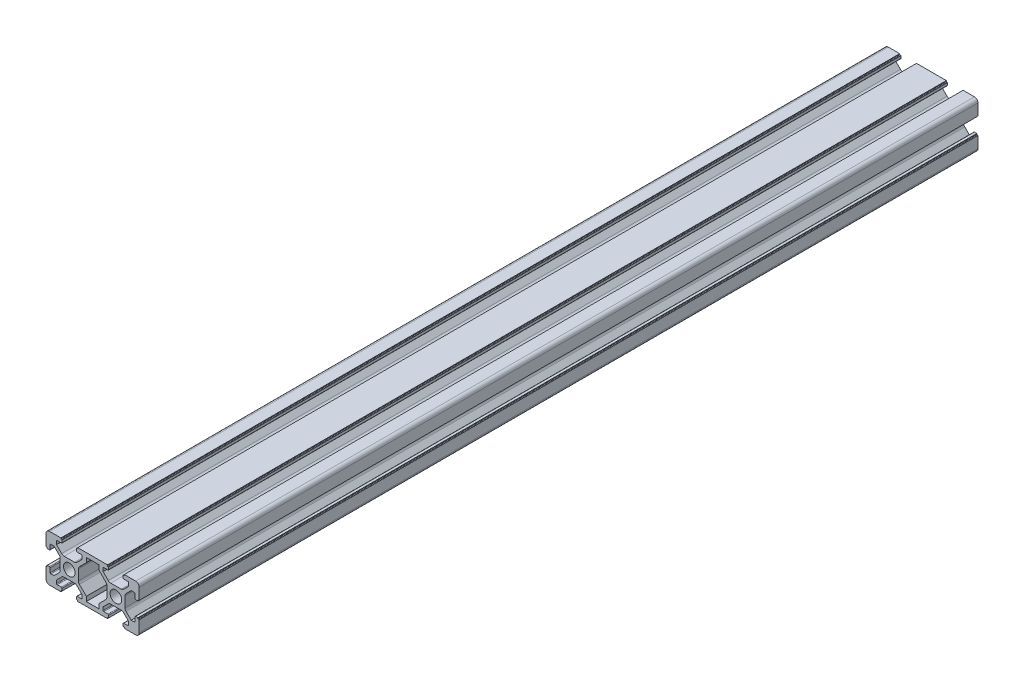
from build123d import *

# Parameters (mm, degrees)
SKETCH_1_R      = 2.5
EXTRUDE_1_DEPTH = 360


with BuildPart() as part:
    # 草图1 → 凸台-拉伸1 (new body)
    with BuildSketch(Plane.XY):
        with BuildLine():
            Line((-0.771587854, 9.545792426), (-5.671587854, 9.545792426))
            Line((-5.671587854, 9.545792426), (-5.671587854, 9.245792426))
            ThreePointArc((-5.671587854, 9.245792426), (-5.730166498, 9.10437107), (-5.871587854, 9.045792426))
            Line((-5.871587854, 9.045792426), (-6.171587854, 9.045792426))
            Line((-6.171587854, 9.045792426), (-6.171587854, 8.045792426))
            ThreePointArc((-6.171587854, 8.045792426), (-6.083719889, 7.833660392), (-5.871587854, 7.745792426))
            Line((-5.871587854, 7.745792426), (-4.071587854, 7.745792426))
            ThreePointArc((-4.071587854, 7.745792426), (-3.85945582, 7.657924461), (-3.771587854, 7.445792426))
            Line((-3.771587854, 7.445792426), (-3.771587854, 6.105792426))
            Line((-3.771587854, 6.105792426), (-5.992248026, 3.885132255))
            ThreePointArc((-5.992248026, 3.885132255), (-6.478883049, 3.559973128), (-7.052908198, 3.445792426))
            Line((-7.052908198, 3.445792426), (-11.490267511, 3.445792426))
            ThreePointArc((-11.490267511, 3.445792426), (-12.064292659, 3.559973128), (-12.550927682, 3.885132255))
            Line((-12.550927682, 3.885132255), (-14.771587854, 6.105792426))
            Line((-14.771587854, 6.105792426), (-14.771587854, 7.445792426))
            ThreePointArc((-14.771587854, 7.445792426), (-14.683719889, 7.657924461), (-14.471587854, 7.745792426))
            Line((-14.471587854, 7.745792426), (-12.671587854, 7.745792426))
            ThreePointArc((-12.671587854, 7.745792426), (-12.45945582, 7.833660392), (-12.371587854, 8.045792426))
            Line((-12.371587854, 8.045792426), (-12.371587854, 9.045792426))
            Line((-12.371587854, 9.045792426), (-12.671587854, 9.045792426))
            ThreePointArc((-12.671587854, 9.045792426), (-12.81300921, 9.10437107), (-12.871587854, 9.245792426))
            Line((-12.871587854, 9.245792426), (-12.871587854, 9.545792426))
            Line((-12.871587854, 9.545792426), (-17.771587854, 9.545792426))
            ThreePointArc((-17.771587854, 9.545792426), (-18.832248026, 9.106452598), (-19.271587854, 8.045792426))
            Line((-19.271587854, 8.045792426), (-19.271587854, 3.145792426))
            Line((-19.271587854, 3.145792426), (-18.971587854, 3.145792426))
            ThreePointArc((-18.971587854, 3.145792426), (-18.830166498, 3.087213783), (-18.771587854, 2.945792426))
            Line((-18.771587854, 2.945792426), (-18.771587854, 2.645792426))
            Line((-18.771587854, 2.645792426), (-17.771587854, 2.645792426))
            ThreePointArc((-17.771587854, 2.645792426), (-17.55945582, 2.733660392), (-17.471587854, 2.945792426))
            Line((-17.471587854, 2.945792426), (-17.471587854, 4.745792426))
            ThreePointArc((-17.471587854, 4.745792426), (-17.383719889, 4.957924461), (-17.171587854, 5.045792426))
            Line((-17.171587854, 5.045792426), (-15.831587854, 5.045792426))
            Line((-15.831587854, 5.045792426), (-13.610927682, 2.825132255))
            ThreePointArc((-13.610927682, 2.825132255), (-13.285768555, 2.338497231), (-13.171587854, 1.764472083))
            Line((-13.171587854, 1.764472083), (-13.171587854, -2.67288723))
            ThreePointArc((-13.171587854, -2.67288723), (-13.285768555, -3.246912379), (-13.610927682, -3.733547402))
            Line((-13.610927682, -3.733547402), (-15.831587854, -5.954207574))
            Line((-15.831587854, -5.954207574), (-17.171587854, -5.954207574))
            ThreePointArc((-17.171587854, -5.954207574), (-17.383719889, -5.866339608), (-17.471587854, -5.654207574))
            Line((-17.471587854, -5.654207574), (-17.471587854, -3.854207574))
            ThreePointArc((-17.471587854, -3.854207574), (-17.55945582, -3.642075539), (-17.771587854, -3.554207574))
            Line((-17.771587854, -3.554207574), (-18.771587854, -3.554207574))
            Line((-18.771587854, -3.554207574), (-18.771587854, -3.854207574))
            ThreePointArc((-18.771587854, -3.854207574), (-18.830166498, -3.99562893), (-18.971587854, -4.054207574))
            Line((-18.971587854, -4.054207574), (-19.271587854, -4.054207574))
            Line((-19.271587854, -4.054207574), (-19.271587854, -8.954207574))
            ThreePointArc((-19.271587854, -8.954207574), (-18.832248026, -10.014867745), (-17.771587854, -10.454207574))
            Line((-17.771587854, -10.454207574), (-12.871587854, -10.454207574))
            Line((-12.871587854, -10.454207574), (-12.871587854, -10.154207574))
            ThreePointArc((-12.871587854, -10.154207574), (-12.81300921, -10.012786217), (-12.671587854, -9.954207574))
            Line((-12.671587854, -9.954207574), (-12.371587854, -9.954207574))
            Line((-12.371587854, -9.954207574), (-12.371587854, -8.954207574))
            ThreePointArc((-12.371587854, -8.954207574), (-12.45945582, -8.742075539), (-12.671587854, -8.654207574))
            Line((-12.671587854, -8.654207574), (-14.471587854, -8.654207574))
            ThreePointArc((-14.471587854, -8.654207574), (-14.683719889, -8.566339608), (-14.771587854, -8.354207574))
            Line((-14.771587854, -8.354207574), (-14.771587854, -7.014207574))
            Line((-14.771587854, -7.014207574), (-12.550927682, -4.793547402))
            ThreePointArc((-12.550927682, -4.793547402), (-12.064292659, -4.468388275), (-11.490267511, -4.354207574))
            Line((-11.490267511, -4.354207574), (-7.052908198, -4.354207574))
            ThreePointArc((-7.052908198, -4.354207574), (-6.478883049, -4.468388275), (-5.992248026, -4.793547402))
            Line((-5.992248026, -4.793547402), (-3.771587854, -7.014207574))
            Line((-3.771587854, -7.014207574), (-3.771587854, -8.354207574))
            ThreePointArc((-3.771587854, -8.354207574), (-3.85945582, -8.566339608), (-4.071587854, -8.654207574))
            Line((-4.071587854, -8.654207574), (-5.871587854, -8.654207574))
            ThreePointArc((-5.871587854, -8.654207574), (-6.083719889, -8.742075539), (-6.171587854, -8.954207574))
            Line((-6.171587854, -8.954207574), (-6.171587854, -9.954207574))
            Line((-6.171587854, -9.954207574), (-5.871587854, -9.954207574))
            ThreePointArc((-5.871587854, -9.954207574), (-5.730166498, -10.012786217), (-5.671587854, -10.154207574))
            Line((-5.671587854, -10.154207574), (-5.671587854, -10.454207574))
            Line((-5.671587854, -10.454207574), (-0.771587854, -10.454207574))
            Line((-0.771587854, -10.454207574), (7.128412146, -10.454207574))
            Line((7.128412146, -10.454207574), (7.128412146, -10.154207574))
            ThreePointArc((7.128412146, -10.154207574), (7.18699079, -10.012786217), (7.328412146, -9.954207574))
            Line((7.328412146, -9.954207574), (7.628412146, -9.954207574))
            Line((7.628412146, -9.954207574), (7.628412146, -8.954207574))
            ThreePointArc((7.628412146, -8.954207574), (7.54054418, -8.742075539), (7.328412146, -8.654207574))
            Line((7.328412146, -8.654207574), (5.528412146, -8.654207574))
            ThreePointArc((5.528412146, -8.654207574), (5.316280111, -8.566339608), (5.228412146, -8.354207574))
            Line((5.228412146, -8.354207574), (5.228412146, -7.014207574))
            Line((5.228412146, -7.014207574), (7.449072318, -4.793547402))
            ThreePointArc((7.449072318, -4.793547402), (7.935707341, -4.468388275), (8.509732489, -4.354207574))
            Line((8.509732489, -4.354207574), (12.947091802, -4.354207574))
            ThreePointArc((12.947091802, -4.354207574), (13.521116951, -4.468388275), (14.007751974, -4.793547402))
            Line((14.007751974, -4.793547402), (16.228412146, -7.014207574))
            Line((16.228412146, -7.014207574), (16.228412146, -8.354207574))
            ThreePointArc((16.228412146, -8.354207574), (16.14054418, -8.566339608), (15.928412146, -8.654207574))
            Line((15.928412146, -8.654207574), (14.128412146, -8.654207574))
            ThreePointArc((14.128412146, -8.654207574), (13.916280111, -8.742075539), (13.828412146, -8.954207574))
            Line((13.828412146, -8.954207574), (13.828412146, -9.954207574))
            Line((13.828412146, -9.954207574), (14.128412146, -9.954207574))
            ThreePointArc((14.128412146, -9.954207574), (14.269833502, -10.012786217), (14.328412146, -10.154207574))
            Line((14.328412146, -10.154207574), (14.328412146, -10.454207574))
            Line((14.328412146, -10.454207574), (19.228412146, -10.454207574))
            ThreePointArc((19.228412146, -10.454207574), (20.289072318, -10.014867745), (20.728412146, -8.954207574))
            Line((20.728412146, -8.954207574), (20.728412146, -4.054207574))
            Line((20.728412146, -4.054207574), (20.428412146, -4.054207574))
            ThreePointArc((20.428412146, -4.054207574), (20.28699079, -3.99562893), (20.228412146, -3.854207574))
            Line((20.228412146, -3.854207574), (20.228412146, -3.554207574))
            Line((20.228412146, -3.554207574), (19.228412146, -3.554207574))
            ThreePointArc((19.228412146, -3.554207574), (19.016280111, -3.642075539), (18.928412146, -3.854207574))
            Line((18.928412146, -3.854207574), (18.928412146, -5.654207574))
            ThreePointArc((18.928412146, -5.654207574), (18.84054418, -5.866339608), (18.628412146, -5.954207574))
            Line((18.628412146, -5.954207574), (17.288412146, -5.954207574))
            Line((17.288412146, -5.954207574), (15.067751974, -3.733547402))
            ThreePointArc((15.067751974, -3.733547402), (14.742592847, -3.246912379), (14.628412146, -2.67288723))
            Line((14.628412146, -2.67288723), (14.628412146, 1.764472083))
            ThreePointArc((14.628412146, 1.764472083), (14.742592847, 2.338497231), (15.067751974, 2.825132255))
            Line((15.067751974, 2.825132255), (17.288412146, 5.045792426))
            Line((17.288412146, 5.045792426), (18.628412146, 5.045792426))
            ThreePointArc((18.628412146, 5.045792426), (18.84054418, 4.957924461), (18.928412146, 4.745792426))
            Line((18.928412146, 4.745792426), (18.928412146, 2.945792426))
            ThreePointArc((18.928412146, 2.945792426), (19.016280111, 2.733660392), (19.228412146, 2.645792426))
            Line((19.228412146, 2.645792426), (20.228412146, 2.645792426))
            Line((20.228412146, 2.645792426), (20.228412146, 2.945792426))
            ThreePointArc((20.228412146, 2.945792426), (20.28699079, 3.087213783), (20.428412146, 3.145792426))
            Line((20.428412146, 3.145792426), (20.728412146, 3.145792426))
            Line((20.728412146, 3.145792426), (20.728412146, 8.045792426))
            ThreePointArc((20.728412146, 8.045792426), (20.289072318, 9.106452598), (19.228412146, 9.545792426))
            Line((19.228412146, 9.545792426), (14.328412146, 9.545792426))
            Line((14.328412146, 9.545792426), (14.328412146, 9.245792426))
            ThreePointArc((14.328412146, 9.245792426), (14.269833502, 9.10437107), (14.128412146, 9.045792426))
            Line((14.128412146, 9.045792426), (13.828412146, 9.045792426))
            Line((13.828412146, 9.045792426), (13.828412146, 8.045792426))
            ThreePointArc((13.828412146, 8.045792426), (13.916280111, 7.833660392), (14.128412146, 7.745792426))
            Line((14.128412146, 7.745792426), (15.928412146, 7.745792426))
            ThreePointArc((15.928412146, 7.745792426), (16.14054418, 7.657924461), (16.228412146, 7.445792426))
            Line((16.228412146, 7.445792426), (16.228412146, 6.105792426))
            Line((16.228412146, 6.105792426), (14.007751974, 3.885132255))
            ThreePointArc((14.007751974, 3.885132255), (13.521116951, 3.559973128), (12.947091802, 3.445792426))
            Line((12.947091802, 3.445792426), (8.509732489, 3.445792426))
            ThreePointArc((8.509732489, 3.445792426), (7.935707341, 3.559973128), (7.449072318, 3.885132255))
            Line((7.449072318, 3.885132255), (5.228412146, 6.105792426))
            Line((5.228412146, 6.105792426), (5.228412146, 7.445792426))
            ThreePointArc((5.228412146, 7.445792426), (5.316280111, 7.657924461), (5.528412146, 7.745792426))
            Line((5.528412146, 7.745792426), (7.328412146, 7.745792426))
            ThreePointArc((7.328412146, 7.745792426), (7.54054418, 7.833660392), (7.628412146, 8.045792426))
            Line((7.628412146, 8.045792426), (7.628412146, 9.045792426))
            Line((7.628412146, 9.045792426), (7.328412146, 9.045792426))
            ThreePointArc((7.328412146, 9.045792426), (7.18699079, 9.10437107), (7.128412146, 9.245792426))
            Line((7.128412146, 9.245792426), (7.128412146, 9.545792426))
            Line((7.128412146, 9.545792426), (2.228412146, 9.545792426))
            Line((2.228412146, 9.545792426), (-0.771587854, 9.545792426))
        make_face()
        with Locations(Location((10.728412146, -0.454207574, 0), (0, 0, 180))):
            Circle(SKETCH_1_R, mode=Mode.SUBTRACT)
        with Locations(Location((-9.271587854, -0.454207574, 0), (0, 0, 180))):
            Circle(SKETCH_1_R, mode=Mode.SUBTRACT)
        with BuildLine():
            Line((-1.971587854, -6.694207574), (-4.932248026, -3.733547402))
            ThreePointArc((-4.932248026, -3.733547402), (-5.257407153, -3.246912379), (-5.371587854, -2.67288723))
            Line((-5.371587854, -2.67288723), (-5.371587854, 1.764472083))
            ThreePointArc((-5.371587854, 1.764472083), (-5.257407153, 2.338497231), (-4.932248026, 2.825132255))
            Line((-4.932248026, 2.825132255), (-1.971587854, 5.785792426))
            Line((-1.971587854, 5.785792426), (-1.971587854, 7.745792426))
            Line((-1.971587854, 7.745792426), (3.428412146, 7.745792426))
            Line((3.428412146, 7.745792426), (3.428412146, 5.785792426))
            Line((3.428412146, 5.785792426), (6.389072318, 2.825132255))
            ThreePointArc((6.389072318, 2.825132255), (6.714231445, 2.338497231), (6.828412146, 1.764472083))
            Line((6.828412146, 1.764472083), (6.828412146, -2.67288723))
            ThreePointArc((6.828412146, -2.67288723), (6.714231445, -3.246912379), (6.389072318, -3.733547402))
            Line((6.389072318, -3.733547402), (3.428412146, -6.694207574))
            Line((3.428412146, -6.694207574), (3.428412146, -8.654207574))
            Line((3.428412146, -8.654207574), (-1.971587854, -8.654207574))
            Line((-1.971587854, -8.654207574), (-1.971587854, -6.694207574))
        make_face(mode=Mode.SUBTRACT)
    extrude(amount=EXTRUDE_1_DEPTH)


solid = part.part
